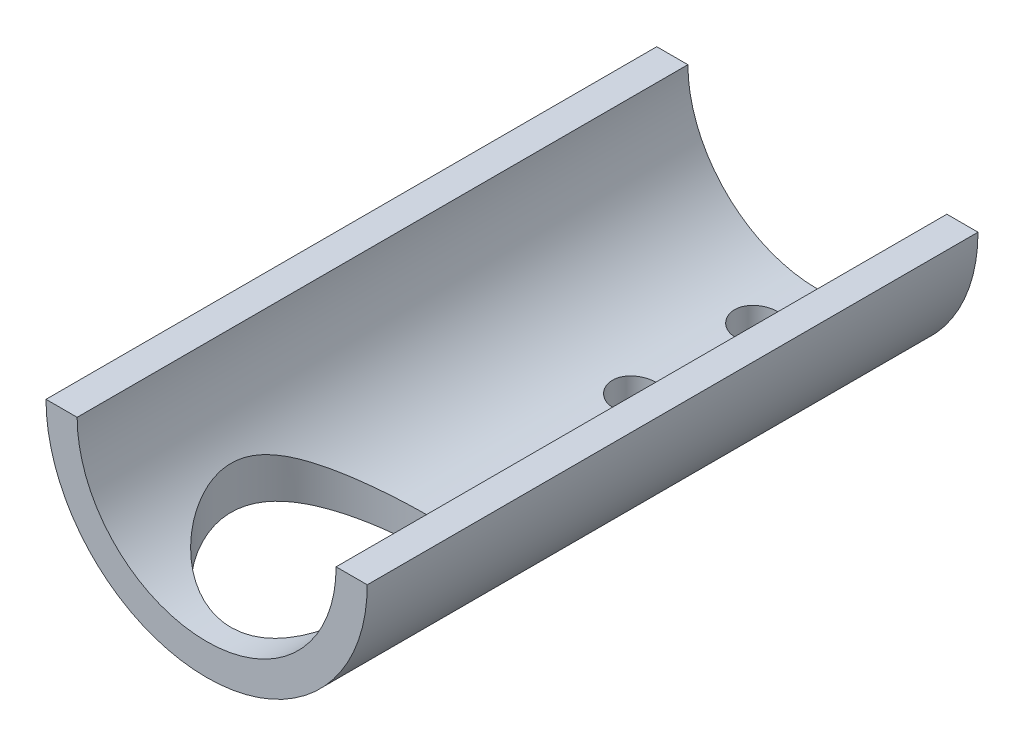
from build123d import *

# Parameters (mm, degrees)
BOSS_EXTRUDE1_DEPTH     = 63.5
CUT_EXTRUDE1_REACH      = 69.75
CUT_EXTRUDE1_END_RADIUS = 16.7005
SKETCH2_R               = 10.16
CUT_EXTRUDE2_REACH      = 69.75
CUT_EXTRUDE2_END_RADIUS = 16.7005
SKETCH5_R               = 2.25
SKETCH8_R               = 5
CUT_EXTRUDE4_DEPTH      = 2.032


with BuildPart() as part:
    # Sketch1 → Boss-Extrude1 (new body)
    with BuildSketch(Plane.XY):
        with BuildLine():
            ThreePointArc((13.462, 0), (0, -13.462), (-13.462, 0))
            Line((-13.462, 0), (-16.7005, 0))
            ThreePointArc((-16.7005, 0), (0, -16.7005), (16.7005, 0))
            Line((16.7005, 0), (13.462, 0))
        make_face()
    extrude(amount=BOSS_EXTRUDE1_DEPTH)

    # Cut-Extrude1: up to this cylinder (the profile starts inside it)
    cut_extrude1_end = Plane(origin=(0, 0, 50.8), z_dir=(0, 0, -1)) * Cylinder(CUT_EXTRUDE1_END_RADIUS, 173.901, mode=Mode.PRIVATE)
    # Sketch2 → Cut-Extrude1 (cut, up to the surface)
    with BuildSketch(Plane(origin=(0, 0, 0), x_dir=(1, 0, 0), z_dir=(0, 1, 0)), mode=Mode.PRIVATE) as cut_extrude1_sk1:
        with Locations(Location((0, -50.8, 0), (0, 0, 270))):
            Circle(SKETCH2_R)
    cut_extrude1_tool1 = extrude(cut_extrude1_sk1.sketch, amount=-CUT_EXTRUDE1_REACH, mode=Mode.PRIVATE) & cut_extrude1_end
    add(cut_extrude1_tool1.solids().sort_by_distance((0, 0, 50.8))[0], mode=Mode.SUBTRACT)

    # Cut-Extrude2: up to this cylinder (the profile starts inside it)
    cut_extrude2_end = Plane(origin=(0, 0, 12.7), z_dir=(0, 0, -1)) * Cylinder(CUT_EXTRUDE2_END_RADIUS, 186.601, mode=Mode.PRIVATE)
    # Sketch5 → Cut-Extrude2 (cut, up to the surface)
    with BuildSketch(Plane(origin=(0, 0, 0), x_dir=(1, 0, 0), z_dir=(0, 1, 0)), mode=Mode.PRIVATE) as cut_extrude2_sk1:
        with Locations(Location((0, -6.35, 0), (0, 0, 270))):
            Circle(SKETCH5_R)
    cut_extrude2_tool1 = extrude(cut_extrude2_sk1.sketch, amount=-CUT_EXTRUDE2_REACH, mode=Mode.PRIVATE) & cut_extrude2_end
    add(cut_extrude2_tool1.solids().sort_by_distance((0, 0, 6.35))[0], mode=Mode.SUBTRACT)
    # Sketch5 → Cut-Extrude2 (cut, up to the surface)
    with BuildSketch(Plane(origin=(0, 0, 0), x_dir=(1, 0, 0), z_dir=(0, 1, 0)), mode=Mode.PRIVATE) as cut_extrude2_sk2:
        with Locations(Location((0, -19.05, 0), (0, 0, 270))):
            Circle(SKETCH5_R)
    cut_extrude2_tool2 = extrude(cut_extrude2_sk2.sketch, amount=-CUT_EXTRUDE2_REACH, mode=Mode.PRIVATE) & cut_extrude2_end
    add(cut_extrude2_tool2.solids().sort_by_distance((0, 0, 19.05))[0], mode=Mode.SUBTRACT)

    # Sketch8 → Cut-Extrude4 (cut)
    with BuildSketch(Plane(origin=(0, -17.78, 0), x_dir=(1, 0, 0), z_dir=(0, 1, 0))):
        with Locations(Location((0, -6.35, 0), (0, 0, 90))):
            Circle(SKETCH8_R)
        with Locations(Location((0, -19.05, 0), (0, 0, 90))):
            Circle(SKETCH8_R)
    extrude(amount=CUT_EXTRUDE4_DEPTH, mode=Mode.SUBTRACT)


solid = part.part
